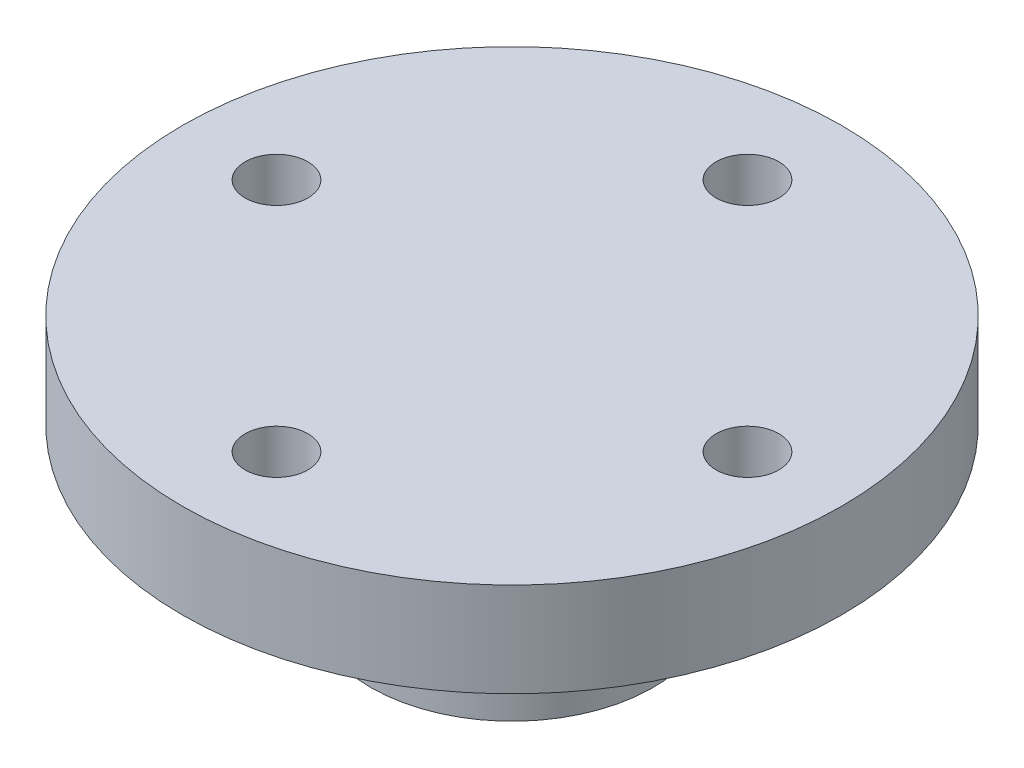
from build123d import *

# Parameters (mm, degrees)
SKETCH_1_R          = 4.5
EXTRUDE_1_DEPTH     = 8
SKETCH_2_R          = 10.5
EXTRUDE_2_DEPTH     = 3
SKETCH_3_R          = 2.8
CUT_EXTRUDE_1_DEPTH = 2.5
SKETCH_4_W          = 0.1
SKETCH_4_H          = 0.149528314
SKETCH_4_W_2        = 0.149528314
SKETCH_4_H_2        = 0.1
CUT_EXTRUDE_2_DEPTH = 2.5
CUT_EXTRUDE_3_REACH = 18.867
SKETCH_5_R          = 1


with BuildPart() as part:
    # 草图1 → 凸台-拉伸1 (new body)
    with BuildSketch(Plane(origin=(0, 0, 0), x_dir=(1, 0, 0), z_dir=(0, 1, 0))):
        with Locations(Location((0, 0, 0), (0, 0, 270))):
            Circle(SKETCH_1_R)
    extrude(amount=EXTRUDE_1_DEPTH)

    # 草图2 → 凸台-拉伸2 (add)
    with BuildSketch(Plane(origin=(0, 8, 0), x_dir=(1, 0, 0), z_dir=(0, 1, 0))):
        with Locations(Location((0, 0, 0), (0, 0, 270))):
            Circle(SKETCH_2_R)
    extrude(amount=-EXTRUDE_2_DEPTH)

    # 草图3 → 切除-拉伸1 (cut)
    with BuildSketch(Plane.XZ):
        with Locations(Location((0, 0, 0), (0, 0, 270))):
            Circle(SKETCH_3_R)
    extrude(amount=-CUT_EXTRUDE_1_DEPTH, mode=Mode.SUBTRACT)

    # 草图4 → 切除-拉伸2 (cut)
    with BuildSketch(Plane.XZ):
        Polygon((0.130606599, 2.872230992), (0.230409271, 2.865951941), (0.221020311, 2.716718687), (0.121217638, 2.722997739), align=None)
        with Locations((0, 2.8)):
            Rectangle(SKETCH_4_W, SKETCH_4_H)
        Polygon((0.310697752, 2.858362445), (0.409909223, 2.845829121), (0.391168356, 2.697479883), (0.291956885, 2.710013206), align=None)
        Polygon((0.489562724, 2.833213246), (0.587791449, 2.814475114), (0.559772637, 2.667595358), (0.461543912, 2.68633349), align=None)
        Polygon((0.666495616, 2.796882649), (0.763353932, 2.77201366), (0.726167752, 2.627183053), (0.629309436, 2.652052042), align=None)
        Polygon((0.840798153, 2.749514034), (0.935903805, 2.718612335), (0.889697015, 2.576402457), (0.794591363, 2.607304157), align=None)
        Polygon((1.011782445, 2.691294343), (1.104760094, 2.654481888), (1.04971505, 2.515453978), (0.956737401, 2.552266433), align=None)
        Polygon((1.178773694, 2.622453343), (1.269256399, 2.579875414), (1.205590339, 2.444578151), (1.115107634, 2.48715608), align=None)
        Polygon((1.341112861, 2.543262718), (1.428743529, 2.495087351), (1.356707714, 2.36405469), (1.269077046, 2.412230058), align=None)
        Polygon((1.498159268, 2.454034997), (1.582592061, 2.400452317), (1.502470784, 2.274201386), (1.418037991, 2.327784066), align=None)
        Polygon((1.649293126, 2.35512232), (1.730194825, 2.296343795), (1.642304287, 2.175372848), (1.561402588, 2.234151373), align=None)
        Polygon((1.793917976, 2.246915052), (1.870969301, 2.183172653), (1.775656366, 2.067959107), (1.698605042, 2.131701506), align=None)
        Polygon((1.931463052, 2.129840237), (2.004359915, 2.061385526), (1.902000741, 1.952384077), (1.829103878, 2.020838787), align=None)
        Polygon((2.061385526, 2.004359915), (2.129840237, 1.931463052), (2.020838787, 1.829103878), (1.952384077, 1.902000741), align=None)
        Polygon((2.183172653, 1.870969301), (2.246915052, 1.793917976), (2.131701506, 1.698605042), (2.067959107, 1.775656366), align=None)
        Polygon((2.296343795, 1.730194825), (2.35512232, 1.649293126), (2.234151373, 1.561402588), (2.175372848, 1.642304287), align=None)
        Polygon((2.400452317, 1.582592061), (2.454034997, 1.498159268), (2.327784066, 1.418037991), (2.274201386, 1.502470784), align=None)
        Polygon((2.495087351, 1.428743529), (2.543262718, 1.341112861), (2.412230058, 1.269077046), (2.36405469, 1.356707714), align=None)
        Polygon((2.579875414, 1.269256399), (2.622453343, 1.178773694), (2.48715608, 1.115107634), (2.444578151, 1.205590339), align=None)
        Polygon((2.654481888, 1.104760094), (2.691294343, 1.011782445), (2.552266433, 0.956737401), (2.515453978, 1.04971505), align=None)
        Polygon((2.718612335, 0.935903805), (2.749514034, 0.840798153), (2.607304157, 0.794591363), (2.576402457, 0.889697015), align=None)
        Polygon((2.77201366, 0.763353932), (2.796882649, 0.666495616), (2.652052042, 0.629309436), (2.627183053, 0.726167752), align=None)
        Polygon((2.814475114, 0.587791449), (2.833213246, 0.489562724), (2.68633349, 0.461543912), (2.667595358, 0.559772637), align=None)
        Polygon((2.845829121, 0.409909223), (2.858362445, 0.310697752), (2.710013206, 0.291956885), (2.697479883, 0.391168356), align=None)
        Polygon((2.865951941, 0.230409271), (2.872230992, 0.130606599), (2.722997739, 0.121217638), (2.716718687, 0.221020311), align=None)
        with Locations((2.8, 0)):
            Rectangle(SKETCH_4_W_2, SKETCH_4_H_2)
        Polygon((2.872230992, -0.130606599), (2.865951941, -0.230409271), (2.716718687, -0.221020311), (2.722997739, -0.121217638), align=None)
        Polygon((2.858362445, -0.310697752), (2.845829121, -0.409909223), (2.697479883, -0.391168356), (2.710013206, -0.291956885), align=None)
        Polygon((2.833213246, -0.489562724), (2.814475114, -0.587791449), (2.667595358, -0.559772637), (2.68633349, -0.461543912), align=None)
        Polygon((2.796882649, -0.666495616), (2.77201366, -0.763353932), (2.627183053, -0.726167752), (2.652052042, -0.629309436), align=None)
        Polygon((2.749514034, -0.840798153), (2.718612335, -0.935903805), (2.576402457, -0.889697015), (2.607304157, -0.794591363), align=None)
        Polygon((2.691294343, -1.011782445), (2.654481888, -1.104760094), (2.515453978, -1.04971505), (2.552266433, -0.956737401), align=None)
        Polygon((2.622453343, -1.178773694), (2.579875414, -1.269256399), (2.444578151, -1.205590339), (2.48715608, -1.115107634), align=None)
        Polygon((2.543262718, -1.341112861), (2.495087351, -1.428743529), (2.36405469, -1.356707714), (2.412230058, -1.269077046), align=None)
        Polygon((2.454034997, -1.498159268), (2.400452317, -1.582592061), (2.274201386, -1.502470784), (2.327784066, -1.418037991), align=None)
        Polygon((2.35512232, -1.649293126), (2.296343795, -1.730194825), (2.175372848, -1.642304287), (2.234151373, -1.561402588), align=None)
        Polygon((2.246915052, -1.793917976), (2.183172653, -1.870969301), (2.067959107, -1.775656366), (2.131701506, -1.698605042), align=None)
        Polygon((2.129840237, -1.931463052), (2.061385526, -2.004359915), (1.952384077, -1.902000741), (2.020838787, -1.829103878), align=None)
        Polygon((2.004359915, -2.061385526), (1.931463052, -2.129840237), (1.829103878, -2.020838787), (1.902000741, -1.952384077), align=None)
        Polygon((1.870969301, -2.183172653), (1.793917976, -2.246915052), (1.698605042, -2.131701506), (1.775656366, -2.067959107), align=None)
        Polygon((1.730194825, -2.296343795), (1.649293126, -2.35512232), (1.561402588, -2.234151373), (1.642304287, -2.175372848), align=None)
        Polygon((1.582592061, -2.400452317), (1.498159268, -2.454034997), (1.418037991, -2.327784066), (1.502470784, -2.274201386), align=None)
        Polygon((1.428743529, -2.495087351), (1.341112861, -2.543262718), (1.269077046, -2.412230058), (1.356707714, -2.36405469), align=None)
        Polygon((1.269256399, -2.579875414), (1.178773694, -2.622453343), (1.115107634, -2.48715608), (1.205590339, -2.444578151), align=None)
        Polygon((1.104760094, -2.654481888), (1.011782445, -2.691294343), (0.956737401, -2.552266433), (1.04971505, -2.515453978), align=None)
        Polygon((0.935903805, -2.718612335), (0.840798153, -2.749514034), (0.794591363, -2.607304157), (0.889697015, -2.576402457), align=None)
        Polygon((0.763353932, -2.77201366), (0.666495616, -2.796882649), (0.629309436, -2.652052042), (0.726167752, -2.627183053), align=None)
        Polygon((0.587791449, -2.814475114), (0.489562724, -2.833213246), (0.461543912, -2.68633349), (0.559772637, -2.667595358), align=None)
        Polygon((0.409909223, -2.845829121), (0.310697752, -2.858362445), (0.291956885, -2.710013206), (0.391168356, -2.697479883), align=None)
        Polygon((0.230409271, -2.865951941), (0.130606599, -2.872230992), (0.121217638, -2.722997739), (0.221020311, -2.716718687), align=None)
        with Locations((0, -2.8)):
            Rectangle(SKETCH_4_W, SKETCH_4_H)
        Polygon((-0.130606599, -2.872230992), (-0.230409271, -2.865951941), (-0.221020311, -2.716718687), (-0.121217638, -2.722997739), align=None)
        Polygon((-0.310697752, -2.858362445), (-0.409909223, -2.845829121), (-0.391168356, -2.697479883), (-0.291956885, -2.710013206), align=None)
        Polygon((-0.489562724, -2.833213246), (-0.587791449, -2.814475114), (-0.559772637, -2.667595358), (-0.461543912, -2.68633349), align=None)
        Polygon((-0.666495616, -2.796882649), (-0.763353932, -2.77201366), (-0.726167752, -2.627183053), (-0.629309436, -2.652052042), align=None)
        Polygon((-0.840798153, -2.749514034), (-0.935903805, -2.718612335), (-0.889697015, -2.576402457), (-0.794591363, -2.607304157), align=None)
        Polygon((-1.011782445, -2.691294343), (-1.104760094, -2.654481888), (-1.04971505, -2.515453978), (-0.956737401, -2.552266433), align=None)
        Polygon((-1.178773694, -2.622453343), (-1.269256399, -2.579875414), (-1.205590339, -2.444578151), (-1.115107634, -2.48715608), align=None)
        Polygon((-1.341112861, -2.543262718), (-1.428743529, -2.495087351), (-1.356707714, -2.36405469), (-1.269077046, -2.412230058), align=None)
        Polygon((-1.498159268, -2.454034997), (-1.582592061, -2.400452317), (-1.502470784, -2.274201386), (-1.418037991, -2.327784066), align=None)
        Polygon((-1.649293126, -2.35512232), (-1.730194825, -2.296343795), (-1.642304287, -2.175372848), (-1.561402588, -2.234151373), align=None)
        Polygon((-1.793917976, -2.246915052), (-1.870969301, -2.183172653), (-1.775656366, -2.067959107), (-1.698605042, -2.131701506), align=None)
        Polygon((-1.931463052, -2.129840237), (-2.004359915, -2.061385526), (-1.902000741, -1.952384077), (-1.829103878, -2.020838787), align=None)
        Polygon((-2.061385526, -2.004359915), (-2.129840237, -1.931463052), (-2.020838787, -1.829103878), (-1.952384077, -1.902000741), align=None)
        Polygon((-2.183172653, -1.870969301), (-2.246915052, -1.793917976), (-2.131701506, -1.698605042), (-2.067959107, -1.775656366), align=None)
        Polygon((-2.296343795, -1.730194825), (-2.35512232, -1.649293126), (-2.234151373, -1.561402588), (-2.175372848, -1.642304287), align=None)
        Polygon((-2.400452317, -1.582592061), (-2.454034997, -1.498159268), (-2.327784066, -1.418037991), (-2.274201386, -1.502470784), align=None)
        Polygon((-2.495087351, -1.428743529), (-2.543262718, -1.341112861), (-2.412230058, -1.269077046), (-2.36405469, -1.356707714), align=None)
        Polygon((-2.579875414, -1.269256399), (-2.622453343, -1.178773694), (-2.48715608, -1.115107634), (-2.444578151, -1.205590339), align=None)
        Polygon((-2.654481888, -1.104760094), (-2.691294343, -1.011782445), (-2.552266433, -0.956737401), (-2.515453978, -1.04971505), align=None)
        Polygon((-2.718612335, -0.935903805), (-2.749514034, -0.840798153), (-2.607304157, -0.794591363), (-2.576402457, -0.889697015), align=None)
        Polygon((-2.77201366, -0.763353932), (-2.796882649, -0.666495616), (-2.652052042, -0.629309436), (-2.627183053, -0.726167752), align=None)
        Polygon((-2.814475114, -0.587791449), (-2.833213246, -0.489562724), (-2.68633349, -0.461543912), (-2.667595358, -0.559772637), align=None)
        Polygon((-2.845829121, -0.409909223), (-2.858362445, -0.310697752), (-2.710013206, -0.291956885), (-2.697479883, -0.391168356), align=None)
        Polygon((-2.865951941, -0.230409271), (-2.872230992, -0.130606599), (-2.722997739, -0.121217638), (-2.716718687, -0.221020311), align=None)
        with Locations((-2.8, 0)):
            Rectangle(SKETCH_4_W_2, SKETCH_4_H_2)
        Polygon((-2.872230992, 0.130606599), (-2.865951941, 0.230409271), (-2.716718687, 0.221020311), (-2.722997739, 0.121217638), align=None)
        Polygon((-2.858362445, 0.310697752), (-2.845829121, 0.409909223), (-2.697479883, 0.391168356), (-2.710013206, 0.291956885), align=None)
        Polygon((-2.833213246, 0.489562724), (-2.814475114, 0.587791449), (-2.667595358, 0.559772637), (-2.68633349, 0.461543912), align=None)
        Polygon((-2.796882649, 0.666495616), (-2.77201366, 0.763353932), (-2.627183053, 0.726167752), (-2.652052042, 0.629309436), align=None)
        Polygon((-2.749514034, 0.840798153), (-2.718612335, 0.935903805), (-2.576402457, 0.889697015), (-2.607304157, 0.794591363), align=None)
        Polygon((-2.691294343, 1.011782445), (-2.654481888, 1.104760094), (-2.515453978, 1.04971505), (-2.552266433, 0.956737401), align=None)
        Polygon((-2.622453343, 1.178773694), (-2.579875414, 1.269256399), (-2.444578151, 1.205590339), (-2.48715608, 1.115107634), align=None)
        Polygon((-2.543262718, 1.341112861), (-2.495087351, 1.428743529), (-2.36405469, 1.356707714), (-2.412230058, 1.269077046), align=None)
        Polygon((-2.454034997, 1.498159268), (-2.400452317, 1.582592061), (-2.274201386, 1.502470784), (-2.327784066, 1.418037991), align=None)
        Polygon((-2.35512232, 1.649293126), (-2.296343795, 1.730194825), (-2.175372848, 1.642304287), (-2.234151373, 1.561402588), align=None)
        Polygon((-2.246915052, 1.793917976), (-2.183172653, 1.870969301), (-2.067959107, 1.775656366), (-2.131701506, 1.698605042), align=None)
        Polygon((-2.129840237, 1.931463052), (-2.061385526, 2.004359915), (-1.952384077, 1.902000741), (-2.020838787, 1.829103878), align=None)
        Polygon((-2.004359915, 2.061385526), (-1.931463052, 2.129840237), (-1.829103878, 2.020838787), (-1.902000741, 1.952384077), align=None)
        Polygon((-1.870969301, 2.183172653), (-1.793917976, 2.246915052), (-1.698605042, 2.131701506), (-1.775656366, 2.067959107), align=None)
        Polygon((-1.730194825, 2.296343795), (-1.649293126, 2.35512232), (-1.561402588, 2.234151373), (-1.642304287, 2.175372848), align=None)
        Polygon((-1.582592061, 2.400452317), (-1.498159268, 2.454034997), (-1.418037991, 2.327784066), (-1.502470784, 2.274201386), align=None)
        Polygon((-1.428743529, 2.495087351), (-1.341112861, 2.543262718), (-1.269077046, 2.412230058), (-1.356707714, 2.36405469), align=None)
        Polygon((-1.269256399, 2.579875414), (-1.178773694, 2.622453343), (-1.115107634, 2.48715608), (-1.205590339, 2.444578151), align=None)
        Polygon((-1.104760094, 2.654481888), (-1.011782445, 2.691294343), (-0.956737401, 2.552266433), (-1.04971505, 2.515453978), align=None)
        Polygon((-0.935903805, 2.718612335), (-0.840798153, 2.749514034), (-0.794591363, 2.607304157), (-0.889697015, 2.576402457), align=None)
        Polygon((-0.763353932, 2.77201366), (-0.666495616, 2.796882649), (-0.629309436, 2.652052042), (-0.726167752, 2.627183053), align=None)
        Polygon((-0.587791449, 2.814475114), (-0.489562724, 2.833213246), (-0.461543912, 2.68633349), (-0.559772637, 2.667595358), align=None)
        Polygon((-0.409909223, 2.845829121), (-0.310697752, 2.858362445), (-0.291956885, 2.710013206), (-0.391168356, 2.697479883), align=None)
        Polygon((-0.230409271, 2.865951941), (-0.130606599, 2.872230992), (-0.121217638, 2.722997739), (-0.221020311, 2.716718687), align=None)
    extrude(amount=-CUT_EXTRUDE_2_DEPTH, mode=Mode.SUBTRACT)

    # 草图5 → 切除-拉伸3 (cut, up to next)
    with BuildSketch(Plane(origin=(0, 8, 0), x_dir=(1, 0, 0), z_dir=(0, 1, 0)), mode=Mode.PRIVATE) as cut_extrude_3_sk1:
        with Locations(Location((0, 7.5, 0), (0, 0, 270))):
            Circle(SKETCH_5_R)
    cut_extrude_3_tool1 = extrude(cut_extrude_3_sk1.sketch, amount=-CUT_EXTRUDE_3_REACH, mode=Mode.PRIVATE) & part.part
    # 草图5 → 切除-拉伸3 (cut, up to next)
    with BuildSketch(Plane(origin=(0, 8, 0), x_dir=(1, 0, 0), z_dir=(0, 1, 0)), mode=Mode.PRIVATE) as cut_extrude_3_sk2:
        with Locations(Location((7.5, 0, 0), (0, 0, 270))):
            Circle(SKETCH_5_R)
    cut_extrude_3_tool2 = extrude(cut_extrude_3_sk2.sketch, amount=-CUT_EXTRUDE_3_REACH, mode=Mode.PRIVATE) & part.part
    # 草图5 → 切除-拉伸3 (cut, up to next)
    with BuildSketch(Plane(origin=(0, 8, 0), x_dir=(1, 0, 0), z_dir=(0, 1, 0)), mode=Mode.PRIVATE) as cut_extrude_3_sk3:
        with Locations(Location((0, -7.5, 0), (0, 0, 270))):
            Circle(SKETCH_5_R)
    cut_extrude_3_tool3 = extrude(cut_extrude_3_sk3.sketch, amount=-CUT_EXTRUDE_3_REACH, mode=Mode.PRIVATE) & part.part
    # 草图5 → 切除-拉伸3 (cut, up to next)
    with BuildSketch(Plane(origin=(0, 8, 0), x_dir=(1, 0, 0), z_dir=(0, 1, 0)), mode=Mode.PRIVATE) as cut_extrude_3_sk4:
        with Locations(Location((-7.5, 0, 0), (0, 0, 270))):
            Circle(SKETCH_5_R)
    cut_extrude_3_tool4 = extrude(cut_extrude_3_sk4.sketch, amount=-CUT_EXTRUDE_3_REACH, mode=Mode.PRIVATE) & part.part
    add(cut_extrude_3_tool1.solids().sort_by_distance((0, 8, -7.5))[0], mode=Mode.SUBTRACT)
    add(cut_extrude_3_tool2.solids().sort_by_distance((7.5, 8, 0))[0], mode=Mode.SUBTRACT)
    add(cut_extrude_3_tool3.solids().sort_by_distance((0, 8, 7.5))[0], mode=Mode.SUBTRACT)
    add(cut_extrude_3_tool4.solids().sort_by_distance((-7.5, 8, 0))[0], mode=Mode.SUBTRACT)


solid = part.part
